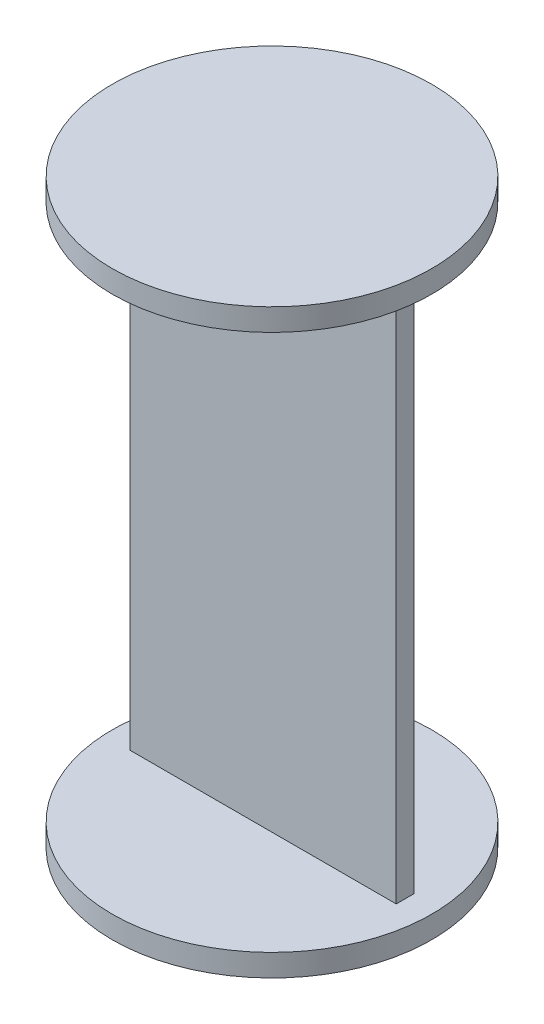
from build123d import *

# Parameters (mm, degrees)
SKETCH1_R           = 45.72
BOSS_EXTRUDE1_DEPTH = 6.35
SKETCH2_W           = 76.2
SKETCH2_H           = 5.08
BOSS_EXTRUDE4_DEPTH = 153.67
SKETCH4_R           = 45.72
BOSS_EXTRUDE5_DEPTH = 6.35


with BuildPart() as part:
    # Sketch1 → Boss-Extrude1 (new body)
    with BuildSketch(Plane(origin=(0, 0, 0), x_dir=(1, 0, 0), z_dir=(0, 1, 0))):
        with Locations(Location((0, 0, 0), (0, 0, 270))):
            Circle(SKETCH1_R)
    extrude(amount=BOSS_EXTRUDE1_DEPTH)

    # Sketch2 → Boss-Extrude4 (add)
    with BuildSketch(Plane(origin=(0, 6.35, 0), x_dir=(1, 0, 0), z_dir=(0, 1, 0))):
        Rectangle(SKETCH2_W, SKETCH2_H)
    extrude(amount=BOSS_EXTRUDE4_DEPTH)

    # Sketch4 → Boss-Extrude5 (add)
    with BuildSketch(Plane(origin=(0, 160.02, 0), x_dir=(1, 0, 0), z_dir=(0, 1, 0))):
        with Locations(Location((0, 0, 0), (0, 0, 270))):
            Circle(SKETCH4_R)
    extrude(amount=BOSS_EXTRUDE5_DEPTH)


solid = part.part
